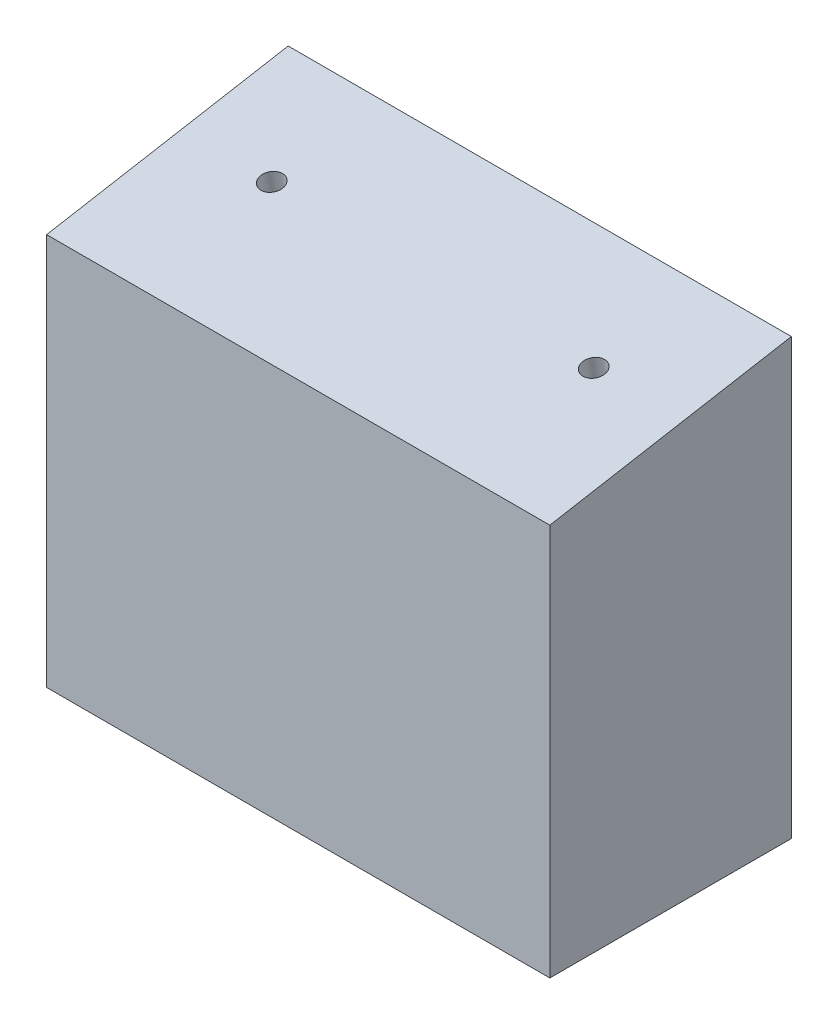
from build123d import *

# Parameters (mm, degrees)
BOSS_EXTRUDE2_DEPTH         = 39.6875
F_1_4_20_TAPPED_HOLE1_D     = 5.1054
F_1_4_20_TAPPED_HOLE1_DEPTH = 22.86
F_1_4_20_TAPPED_HOLE1_TIP   = 1.533816902
F_8_32_TAPPED_HOLE1_D       = 3.4544
F_8_32_TAPPED_HOLE1_DEPTH   = 14.986
F_8_32_TAPPED_HOLE1_TIP     = 1.037806461


with BuildPart() as part:
    # Sketch3 → Boss-Extrude2 (new, symmetric)
    with BuildSketch(Plane(origin=(0, 0, 0), x_dir=(0, 0, -1), z_dir=(1, 0, 0))):
        Polygon((0, 0), (38.1, 0), (38.1, 68.58), (0, 61.861942035), align=None)
    extrude(amount=BOSS_EXTRUDE2_DEPTH, both=True)

    # 1/4-20 Tapped Hole1
    with Locations(Plane(origin=(0, 0, 0), x_dir=(-1, 0, 0), z_dir=(0, -1, 0))):
        with Locations((25.4, 19.05), (-25.4, 19.05)):
            Hole(F_1_4_20_TAPPED_HOLE1_D / 2, depth=F_1_4_20_TAPPED_HOLE1_DEPTH)
            with Locations((0, 0, -(F_1_4_20_TAPPED_HOLE1_DEPTH + F_1_4_20_TAPPED_HOLE1_TIP / 2))):  # 118° drill point
                Cone(0, F_1_4_20_TAPPED_HOLE1_D / 2, F_1_4_20_TAPPED_HOLE1_TIP, mode=Mode.SUBTRACT)

    # #8-32 Tapped Hole1
    with Locations(Plane(origin=(0, 59.996576236, 10.579015141), x_dir=(1, 0, 0), z_dir=(0, 0.9848077530122092, 0.17364817766692348))):
        with Locations((-25.4, 32.284967414), (25.4, 32.284967414)):
            Hole(F_8_32_TAPPED_HOLE1_D / 2, depth=F_8_32_TAPPED_HOLE1_DEPTH)
            with Locations((0, 0, -(F_8_32_TAPPED_HOLE1_DEPTH + F_8_32_TAPPED_HOLE1_TIP / 2))):  # 118° drill point
                Cone(0, F_8_32_TAPPED_HOLE1_D / 2, F_8_32_TAPPED_HOLE1_TIP, mode=Mode.SUBTRACT)


solid = part.part
